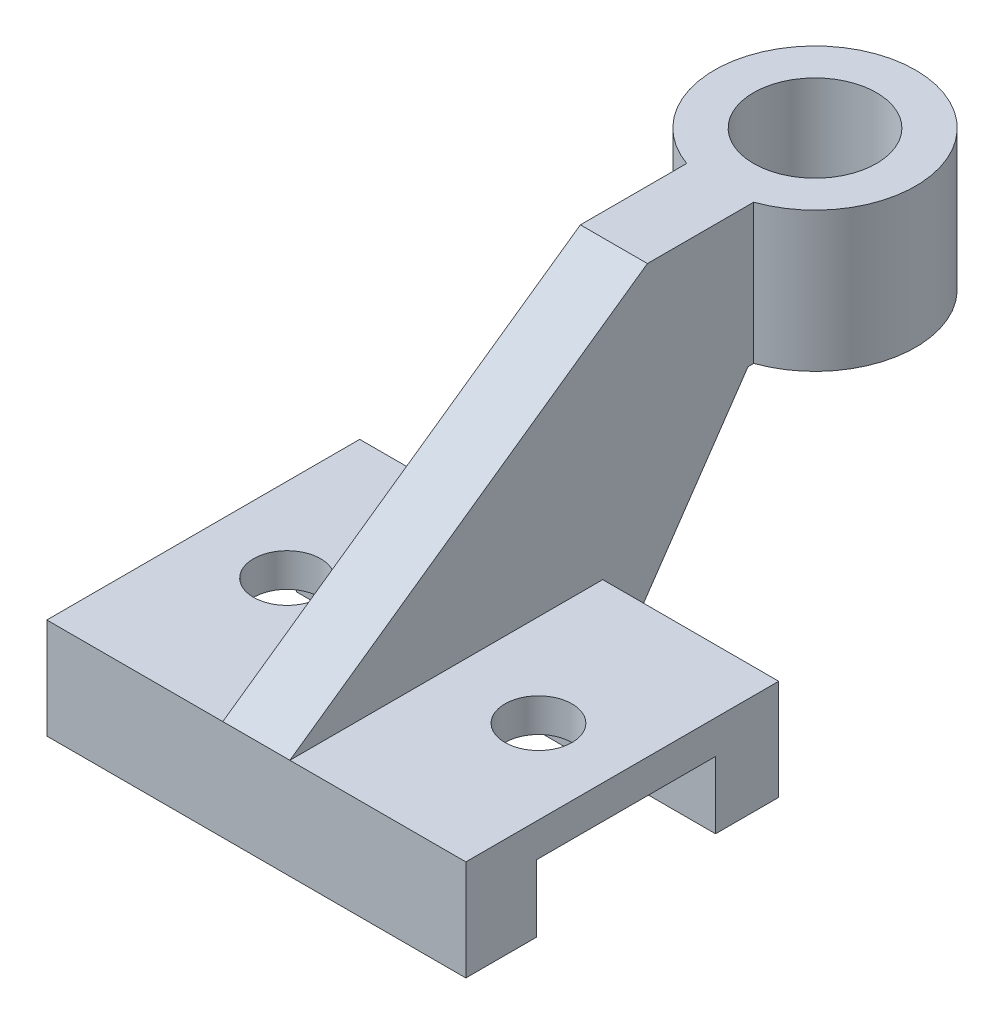
from build123d import *

# Parameters (mm, degrees)
BOSS_EXTRUDE1_DEPTH      = 1905
SKETCH6_R                = 457.2
SKETCH6_R_2              = 279.4
BOSS_EXTRUDE2_DEPTH      = 635
BOSS_EXTRUDE3_DEPTH      = 152.4
BOSS_EXTRUDE3_DEPTH_BACK = 152.4
SKETCH11_R               = 152.4
CUT_EXTRUDE1_DEPTH       = 152.4
SKETCH12_W               = 304.8
SKETCH12_H               = 635
BOSS_EXTRUDE6_DEPTH      = 152.4


with BuildPart() as part:
    # Sketch1 → Boss-Extrude1 (new body)
    with BuildSketch(Plane(origin=(0, 0, 0), x_dir=(0, 0, -1), z_dir=(1, 0, 0))):
        Polygon((-1016.531937173, -597.631413613), (-694.178010471, -597.631413613), (-694.178010471, -292.831413613), (118.621989529, -292.831413613), (118.621989529, -597.631413613), (405.868062827, -597.631413613), (405.868062827, -140.431413613), (-1016.531937173, -140.431413613), align=None)
    extrude(amount=BOSS_EXTRUDE1_DEPTH)

    # Sketch10 → Boss-Extrude3 (add, two sides: drawn at the far end of the back side and taken through both)
    with BuildSketch(Plane(origin=(952.5, 0, 0), x_dir=(0, 0, -1), z_dir=(1, 0, 0)).offset(-BOSS_EXTRUDE3_DEPTH_BACK)):
        Polygon((609.068062827, 1002.568586387), (-1016.531937173, -140.431413613), (405.868062827, -140.431413613), (405.868062827, -597.631413613), (1066.268062827, 367.568586387), (1066.268062827, 1002.568586387), align=None)
    extrude(amount=BOSS_EXTRUDE3_DEPTH + BOSS_EXTRUDE3_DEPTH_BACK)

    # Sketch11 → Cut-Extrude1 (cut)
    with BuildSketch(Plane(origin=(0, -140.431413613, 0), x_dir=(1, 0, 0), z_dir=(0, 1, 0))):
        with Locations(Location((1524, -305.331937173, 0), (0, 0, 270))):
            Circle(SKETCH11_R)
        with Locations(Location((381, -305.331937173, 0), (0, 0, 270))):
            Circle(SKETCH11_R)
    extrude(amount=-CUT_EXTRUDE1_DEPTH, mode=Mode.SUBTRACT)



with BuildPart() as body_2:
    # Sketch6 → Boss-Extrude2 (new body)
    with BuildSketch(Plane(origin=(0, 1002.568586387, 0), x_dir=(1, 0, 0), z_dir=(0, 1, 0))):
        with Locations(Location((952.5, 1523.468062827, 0), (0, 0, 270))):
            Circle(SKETCH6_R)
        with Locations(Location((952.5, 1523.468062827, 0), (0, 0, 270))):
            Circle(SKETCH6_R_2, mode=Mode.SUBTRACT)
    extrude(amount=-BOSS_EXTRUDE2_DEPTH)


with BuildPart() as part_1:
    add(part.part)

    add(body_2.part)  # Boss-Extrude6 merges body 2
    # Sketch12 → Boss-Extrude6 (add)
    with BuildSketch(Plane(origin=(0, 0, -1066.268062827), x_dir=(-1, 0, 0), z_dir=(0, 0, -1))):
        with Locations((-952.5, 685.068586387)):
            Rectangle(SKETCH12_W, SKETCH12_H)
    extrude(amount=BOSS_EXTRUDE6_DEPTH)


solid = part_1.part
